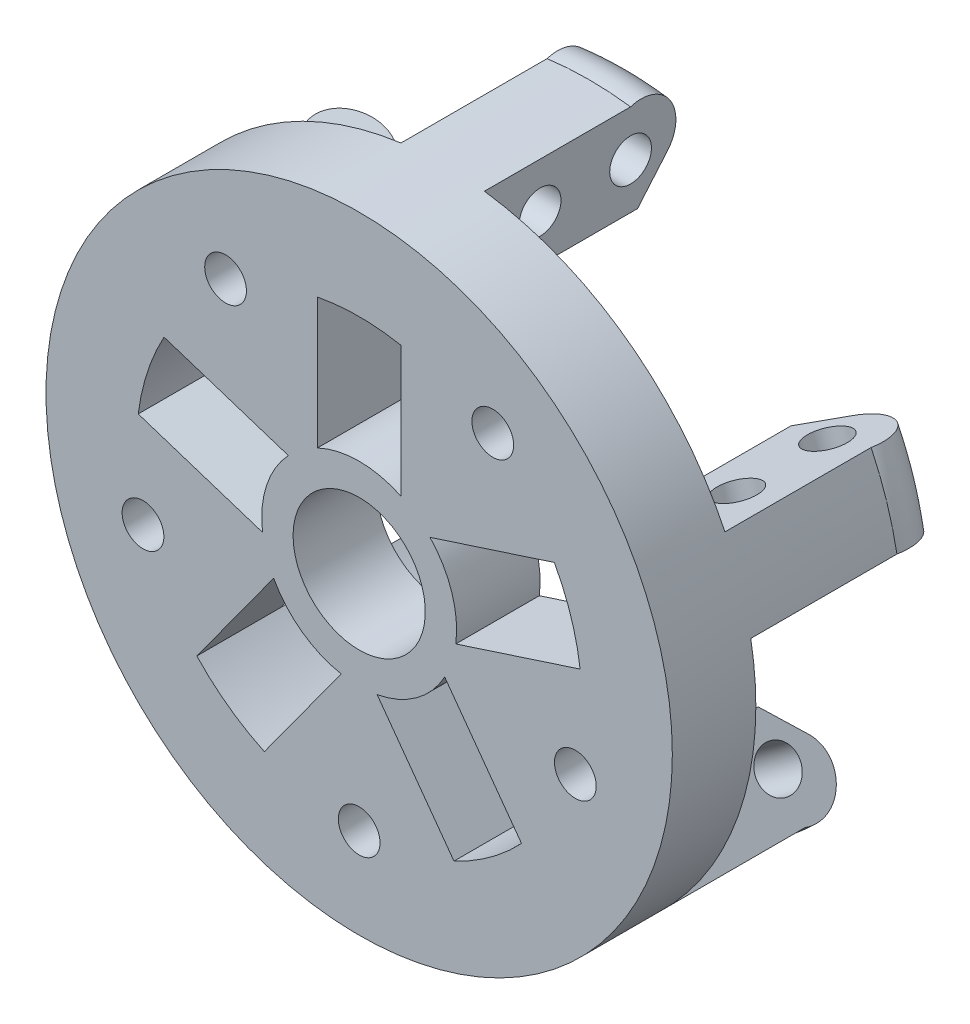
from build123d import *

# Parameters (mm, degrees)
CUT_EXTRUDE_2_DEPTH            = 70.634269506
HOLE_WIZARD_M1_6_1_D           = 6
HOLE_WIZARD_M1_6_1_CBORE_D     = 12
HOLE_WIZARD_M1_6_1_CBORE_DEPTH = 6
PATTERN_CIRCULAR_1_COUNT       = 5
SKETCH_7_R                     = 9.5
CUT_EXTRUDE_3_DEPTH            = 70.482844453
CUT_EXTRUDE_4_DEPTH            = 70.482844453
PATTERN_CIRCULAR_2_COUNT       = 5
SKETCH_9_R                     = 3
CUT_EXTRUDE_5_DEPTH            = 79.791532331
PATTERN_CIRCULAR_3_COUNT       = 5


with BuildPart() as part:
    # 草图1 → 旋转1 (revolve)
    with BuildSketch(Plane(origin=(0, 0, 0), x_dir=(1, 0, 0), z_dir=(0, 1, 0)), mode=Mode.PRIVATE) as revolve_1_sk:
        with BuildLine():
            Line((0, 0), (-45, 0))
            Line((-45, 0), (-45, 12))
            Line((-45, 12), (-45, 33))
            ThreePointArc((-45, 33), (-42.983093835, 38.686059159), (-36.962809534, 38.291906688))
            Line((-36.962809534, 38.291906688), (-32, 34))
            Line((-32, 34), (-32, 12))
            Line((-32, 12), (0, 12))
            Line((0, 12), (0, 0))
        make_face()
    revolve(revolve_1_sk.sketch.rotate(Axis((0, 0, 0), (0, 0, -1)), 180), axis=Axis((0, 0, 0), (0, 0, -1)))

    # 草图2 → 切除-拉伸2 (cut, through all)
    with BuildSketch(Plane(origin=(0, 0, -12), x_dir=(-1, 0, 0), z_dir=(0, 0, -1))):
        with BuildLine():
            Line((-6, 44.833757456), (-6, 12.649110641))
            ThreePointArc((-6, 12.649110641), (-8.228993532, 11.326237921), (-10.175917134, 9.615129249))
            Line((-10.175917134, 9.615129249), (-40.785335212, 19.560732073))
            ThreePointArc((-40.785335212, 19.560732073), (-26.587560075, 36.594636996), (-6, 44.833757456))
        make_face()
        with BuildLine():
            Line((6, 44.833757456), (6, 12.649110641))
            ThreePointArc((6, 12.649110641), (8.228993532, 11.326237921), (10.175917134, 9.615129249))
            Line((10.175917134, 9.615129249), (40.785335212, 19.560732073))
            ThreePointArc((40.785335212, 19.560732073), (26.587560075, 36.594636996), (6, 44.833757456))
        make_face()
        with BuildLine():
            Line((44.493539145, 8.148053878), (13.884121066, -1.797548946))
            ThreePointArc((13.884121066, -1.797548946), (13.314791228, -4.326237921), (12.289062655, -6.706633958))
            Line((12.289062655, -6.706633958), (31.206723404, -32.74456019))
            ThreePointArc((31.206723404, -32.74456019), (43.019575879, -13.977907527), (44.493539145, 8.148053878))
        make_face()
        with BuildLine():
            Line((21.498519471, -39.797983217), (2.580858723, -13.760056986))
            ThreePointArc((2.580858723, -13.760056986), (0, -14), (-2.580858723, -13.760056986))
            Line((-2.580858723, -13.760056986), (-21.498519471, -39.797983217))
            ThreePointArc((-21.498519471, -39.797983217), (0, -45.23345894), (21.498519471, -39.797983217))
        make_face()
        with BuildLine():
            Line((-31.206723404, -32.74456019), (-12.289062655, -6.706633958))
            ThreePointArc((-12.289062655, -6.706633958), (-13.314791228, -4.326237921), (-13.884121066, -1.797548946))
            Line((-13.884121066, -1.797548946), (-44.493539145, 8.148053878))
            ThreePointArc((-44.493539145, 8.148053878), (-43.019575879, -13.977907527), (-31.206723404, -32.74456019))
        make_face()
    extrude(amount=CUT_EXTRUDE_2_DEPTH, mode=Mode.SUBTRACT)

    # M1.6 六角圆柱头螺钉的柱形沉头孔1 (through all)
    with Locations(Plane(origin=(0, 0, -12), x_dir=(-1, 0, 0), z_dir=(0, 0, -1))):
        with Locations((0, -32)):
            hole_wizard_m1_6_1 = CounterBoreHole(HOLE_WIZARD_M1_6_1_D / 2, HOLE_WIZARD_M1_6_1_CBORE_D / 2, HOLE_WIZARD_M1_6_1_CBORE_DEPTH)

    # 阵列(圆周)1: M1.6 六角圆柱头螺钉的柱形沉头孔1 ×5 about axis
    pattern_circular_1_axis = Axis((0, 0.662193987, 0), (0, 0, 1))
    for i in range(1, PATTERN_CIRCULAR_1_COUNT):
        add(hole_wizard_m1_6_1.rotate(pattern_circular_1_axis, i * 360 / PATTERN_CIRCULAR_1_COUNT), mode=Mode.SUBTRACT)

    # 草图7 → 切除-拉伸3 (cut, through all)
    with BuildSketch(Plane(origin=(0, 0, -12), x_dir=(-1, 0, 0), z_dir=(0, 0, -1))):
        Circle(SKETCH_7_R)
    extrude(amount=-CUT_EXTRUDE_3_DEPTH, mode=Mode.SUBTRACT)

    # 草图7<3> → 切除-拉伸4 (cut, through all)
    with BuildSketch(Plane(origin=(0, 0, -12), x_dir=(-1, 0, 0), z_dir=(0, 0, -1))):
        with BuildLine():
            ThreePointArc((6, 31.432467291), (0, 32), (-6, 31.432467291))
            Line((-6, 31.432467291), (-6, 12.649110641))
            ThreePointArc((-6, 12.649110641), (0, 14), (6, 12.649110641))
            Line((6, 12.649110641), (6, 31.432467291))
        make_face()
    cut_extrude_4 = extrude(amount=-CUT_EXTRUDE_4_DEPTH, mode=Mode.SUBTRACT)

    # 阵列(圆周)2: 切除-拉伸4 ×5 about axis
    pattern_circular_2_axis = Axis((0, 0, 0), (0, 0, 1))
    for i in range(1, PATTERN_CIRCULAR_2_COUNT):
        add(cut_extrude_4.rotate(pattern_circular_2_axis, i * 360 / PATTERN_CIRCULAR_2_COUNT), mode=Mode.SUBTRACT)

    # 草图9 → 切除-拉伸5 (cut, through all)
    with BuildSketch(Plane(origin=(6, 0, 0), x_dir=(0, 0, -1), z_dir=(1, 0, 0))):
        with Locations(Location((33, 38, 0), (0, 0, 90))):
            Circle(SKETCH_9_R)
        with Locations(Location((20, 38, 0), (0, 0, 90))):
            Circle(SKETCH_9_R)
    cut_extrude_5 = extrude(amount=-CUT_EXTRUDE_5_DEPTH, mode=Mode.SUBTRACT)

    # 阵列(圆周)3: 切除-拉伸5 ×5 about axis
    pattern_circular_3_axis = Axis((0, 0, 0), (0, 0, -1))
    for i in range(1, PATTERN_CIRCULAR_3_COUNT):
        add(cut_extrude_5.rotate(pattern_circular_3_axis, i * 360 / PATTERN_CIRCULAR_3_COUNT), mode=Mode.SUBTRACT)


solid = part.part
